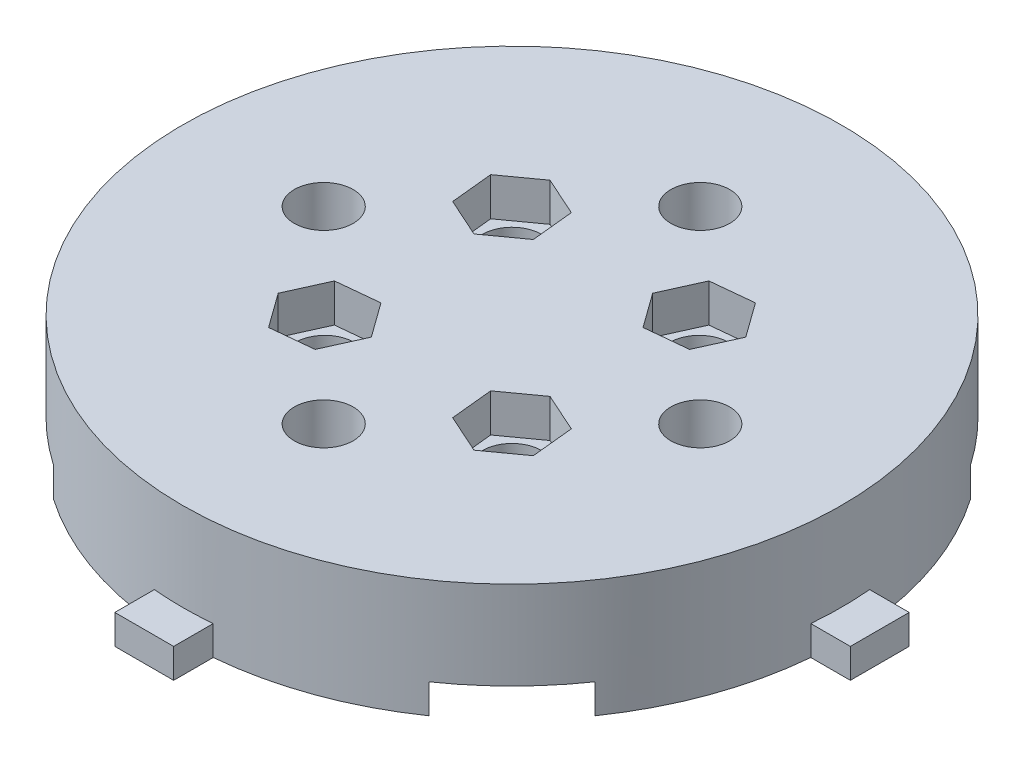
from build123d import *

# Parameters (mm, degrees)
BOSS_EXTRUDE1_DEPTH      = 15
BOSS_EXTRUDE1_DEPTH_BACK = 5
SKETCH1_R                = 56
SKETCH1_R_2              = 5
BOSS_EXTRUDE3_DEPTH      = 5
SKETCH4_R                = 50
CUT_EXTRUDE1_DEPTH       = 10
CUT_EXTRUDE2_DEPTH       = 5
CUT_EXTRUDE5_START       = -10
CUT_EXTRUDE5_DEPTH       = 2.5
CUT_EXTRUDE6_DEPTH       = 6.5


with BuildPart() as part:
    # Sketch1 → Boss-Extrude1 (new, two sides: drawn at the far end of the back side and taken through both)
    with BuildSketch(Plane(origin=(0, 0, 0), x_dir=(1, 0, 0), z_dir=(0, 1, 0)).offset(-BOSS_EXTRUDE1_DEPTH_BACK)):
        with Locations(Location((0, 0, 0), (0, 0, 270))):
            Circle(SKETCH1_R)
        with Locations(Location((15.909902577, 15.909902577, 0), (0, 0, 270))):
            Circle(SKETCH1_R_2, mode=Mode.SUBTRACT)
        with Locations(Location((15.909902577, -15.909902577, 0), (0, 0, 270))):
            Circle(SKETCH1_R_2, mode=Mode.SUBTRACT)
        with Locations(Location((-15.909902577, -15.909902577, 0), (0, 0, 270))):
            Circle(SKETCH1_R_2, mode=Mode.SUBTRACT)
        with Locations(Location((-15.909902577, 15.909902577, 0), (0, 0, 270))):
            Circle(SKETCH1_R_2, mode=Mode.SUBTRACT)
        with Locations(Location((-32, 0, 0), (0, 0, 270))):
            Circle(SKETCH1_R_2, mode=Mode.SUBTRACT)
        with Locations(Location((0, 32, 0), (0, 0, 270))):
            Circle(SKETCH1_R_2, mode=Mode.SUBTRACT)
        with Locations(Location((32, 0, 0), (0, 0, 270))):
            Circle(SKETCH1_R_2, mode=Mode.SUBTRACT)
        with Locations(Location((0, -32, 0), (0, 0, 270))):
            Circle(SKETCH1_R_2, mode=Mode.SUBTRACT)
    extrude(amount=BOSS_EXTRUDE1_DEPTH + BOSS_EXTRUDE1_DEPTH_BACK)

    # Sketch3 → Boss-Extrude3 (add)
    with BuildSketch(Plane.XZ.offset(5)):
        Polygon((-5, 5), (-5, 62.5), (5, 62.5), (5, 5), (62.5, 5), (62.5, -5), (5, -5), (5, -62.5), (-5, -62.5), (-5, -5), (-62.5, -5), (-62.5, 5), align=None)
    extrude(amount=-BOSS_EXTRUDE3_DEPTH)

    # Sketch4 → Cut-Extrude1 (cut)
    with BuildSketch(Plane.XZ.offset(5)):
        with Locations(Location((0, 0, 0), (0, 0, 270))):
            Circle(SKETCH4_R)
    extrude(amount=-CUT_EXTRUDE1_DEPTH, mode=Mode.SUBTRACT)

    # Sketch5 → Cut-Extrude2 (cut)
    with BuildSketch(Plane.XZ.offset(5)):
        with BuildLine():
            Line((27.56994834, 41.712083963), (31.890451666, 46.032587289))
            ThreePointArc((31.890451666, 46.032587289), (39.597979746, 39.597979746), (46.032587289, 31.890451666))
            Line((46.032587289, 31.890451666), (41.712083963, 27.56994834))
            ThreePointArc((41.712083963, 27.56994834), (35.355339059, 35.355339059), (27.56994834, 41.712083963))
        make_face()
        with BuildLine():
            Line((41.712083963, -27.56994834), (46.032587289, -31.890451666))
            ThreePointArc((46.032587289, -31.890451666), (39.597979746, -39.597979746), (31.890451666, -46.032587289))
            Line((31.890451666, -46.032587289), (27.56994834, -41.712083963))
            ThreePointArc((27.56994834, -41.712083963), (35.355339059, -35.355339059), (41.712083963, -27.56994834))
        make_face()
        with BuildLine():
            Line((-27.56994834, -41.712083963), (-31.890451666, -46.032587289))
            ThreePointArc((-31.890451666, -46.032587289), (-39.597979746, -39.597979746), (-46.032587289, -31.890451666))
            Line((-46.032587289, -31.890451666), (-41.712083963, -27.56994834))
            ThreePointArc((-41.712083963, -27.56994834), (-35.355339059, -35.355339059), (-27.56994834, -41.712083963))
        make_face()
        with BuildLine():
            Line((-41.712083963, 27.56994834), (-46.032587289, 31.890451666))
            ThreePointArc((-46.032587289, 31.890451666), (-39.597979746, 39.597979746), (-31.890451666, 46.032587289))
            Line((-31.890451666, 46.032587289), (-27.56994834, 41.712083963))
            ThreePointArc((-27.56994834, 41.712083963), (-35.355339059, 35.355339059), (-41.712083963, 27.56994834))
        make_face()
    extrude(amount=-CUT_EXTRUDE2_DEPTH, mode=Mode.SUBTRACT)

    # Sketch8 → Cut-Extrude5 (cut)
    with BuildSketch(Plane(origin=(0, 15, 0), x_dir=(1, 0, 0), z_dir=(0, 1, 0)).offset(CUT_EXTRUDE5_START)):
        Polygon((-5, 5), (-5.590169944, 5), (-5.590169944, -5), (-5, -5), (-5, -5.590169944), (5, -5.590169944), (5, -5), (5.590169944, -5), (5.590169944, 5), (5, 5), (5, 5.590169944), (-5, 5.590169944), align=None)
    extrude(amount=CUT_EXTRUDE5_DEPTH, mode=Mode.SUBTRACT)

    # Sketch10 → Cut-Extrude6 (cut)
    with BuildSketch(Plane(origin=(0, 15, 0), x_dir=(1, 0, 0), z_dir=(0, 1, 0))):
        Polygon((11.688650249, 21.770596118), (8.723766922, 15.184537596), (12.94501925, 9.323844055), (20.131154904, 10.049209035), (23.096038231, 16.635267557), (18.874785904, 22.495961099), align=None)
        Polygon((-16.635267557, 23.096038231), (-22.495961099, 18.874785904), (-21.770596118, 11.688650249), (-15.184537596, 8.723766922), (-9.323844055, 12.94501925), (-10.049209035, 20.131154904), align=None)
        Polygon((21.770596118, -11.688650249), (15.184537596, -8.723766922), (9.323844055, -12.94501925), (10.049209035, -20.131154904), (16.635267557, -23.096038231), (22.495961099, -18.874785904), align=None)
        Polygon((-11.688650249, -21.770596118), (-8.723766922, -15.184537596), (-12.94501925, -9.323844055), (-20.131154904, -10.049209035), (-23.096038231, -16.635267557), (-18.874785904, -22.495961099), align=None)
    extrude(amount=-CUT_EXTRUDE6_DEPTH, mode=Mode.SUBTRACT)


solid = part.part
